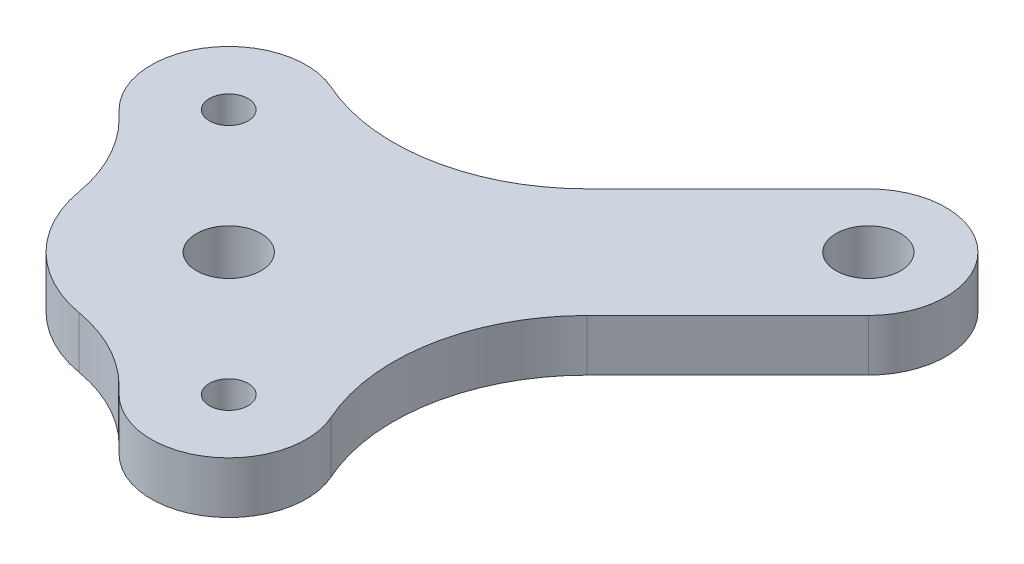
from build123d import *

# Parameters (mm, degrees)
ESQUISSE1_R        = 1.5
ESQUISSE1_R_2      = 2.5
BOSS_EXTRU_1_DEPTH = 2
CONG_1_R           = 12


with BuildPart() as part:
    # Esquisse1 → Boss.-Extru.1 (new, symmetric)
    with BuildSketch(Plane(origin=(0, 29.5, 0), x_dir=(1, 0, 0), z_dir=(0, 1, 0))):
        with BuildLine():
            Line((56.491378029, -49.493903346), (45.612572194, -60.37270918))
            ThreePointArc((45.612572194, -60.37270918), (41.468560381, -68.255453254), (42.524007936, -77.09833279))
            ThreePointArc((42.524007936, -77.09833279), (40.447621803, -84.488468372), (32.803300859, -83.788582233))
            Line((32.803300859, -83.788582233), (28.914213562, -79.899494937))
            ThreePointArc((28.914213562, -79.899494937), (20.428932188, -77.071067812), (17.600505063, -68.585786438))
            Line((17.600505063, -68.585786438), (13.711417767, -64.696699141))
            ThreePointArc((13.711417767, -64.696699141), (13.011531628, -57.052378197), (20.40166721, -54.975992064))
            ThreePointArc((20.40166721, -54.975992064), (29.244546746, -56.031439619), (37.12729082, -51.887427806))
            Line((37.12729082, -51.887427806), (48.006096654, -41.008621971))
            ThreePointArc((48.006096654, -41.008621971), (56.491378029, -41.008621971), (56.491378029, -49.493903346))
        make_face()
        with Locations(Location((17.954058454, -60.454058454, 0), (0, 0, 270))):
            Circle(ESQUISSE1_R, mode=Mode.SUBTRACT)
        with Locations(Location((37.045941546, -79.545941546, 0), (0, 0, 90))):
            Circle(ESQUISSE1_R, mode=Mode.SUBTRACT)
        with Locations(Location((27.5, -70, 0), (0, 0, 270))):
            Circle(ESQUISSE1_R_2, mode=Mode.SUBTRACT)
        with Locations(Location((52.248737342, -45.251262658, 0), (0, 0, 270))):
            Circle(ESQUISSE1_R_2, mode=Mode.SUBTRACT)
    extrude(amount=BOSS_EXTRU_1_DEPTH, both=True)

    # Congé1
    cong_1_edges = [part.edges().sort_by_distance(p)[0] for p in [
        (28.914213562, 29.5, 79.899494937),
        (17.600505063, 29.5, 68.585786438),
    ]]
    fillet(cong_1_edges, radius=CONG_1_R)


solid = part.part
